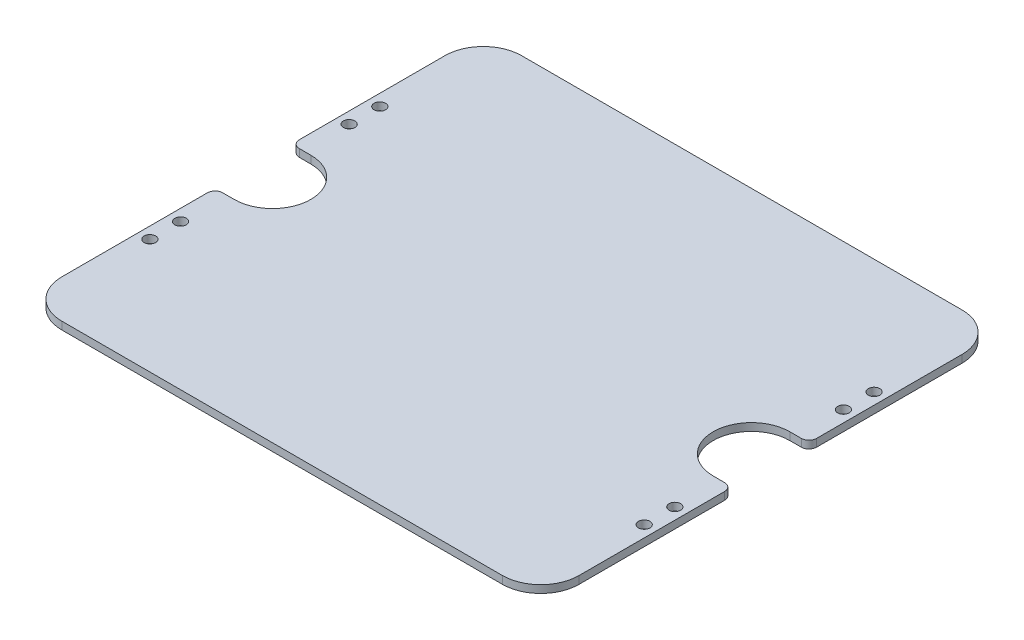
from build123d import *

# Parameters (mm, degrees)
SKETCH_1_R      = 1.5
EXTRUDE_1_DEPTH = 2


with BuildPart() as part:
    # 草图1 → 凸台-拉伸1 (new body)
    with BuildSketch(Plane(origin=(0, 0, 0), x_dir=(1, 0, 0), z_dir=(0, 1, 0))):
        with BuildLine():
            Line((-65.5, 10), (-62.5, 10))
            ThreePointArc((-62.5, 10), (-52.5, 0), (-62.5, -10))
            Line((-62.5, -10), (-65.5, -10))
            ThreePointArc((-65.5, -10), (-66.914213562, -10.585786438), (-67.5, -12))
            Line((-67.5, -12), (-67.5, -50))
            ThreePointArc((-67.5, -50), (-64.571067812, -57.071067812), (-57.5, -60))
            Line((-57.5, -60), (57.5, -60))
            ThreePointArc((57.5, -60), (64.571067812, -57.071067812), (67.5, -50))
            Line((67.5, -50), (67.5, -12))
            ThreePointArc((67.5, -12), (66.914213562, -10.585786438), (65.5, -10))
            Line((65.5, -10), (62.5, -10))
            ThreePointArc((62.5, -10), (52.5, 0), (62.5, 10))
            Line((62.5, 10), (65.5, 10))
            ThreePointArc((65.5, 10), (66.914213562, 10.585786438), (67.5, 12))
            Line((67.5, 12), (67.5, 50))
            ThreePointArc((67.5, 50), (64.571067812, 57.071067812), (57.5, 60))
            Line((57.5, 60), (-57.5, 60))
            ThreePointArc((-57.5, 60), (-64.571067812, 57.071067812), (-67.5, 50))
            Line((-67.5, 50), (-67.5, 12))
            ThreePointArc((-67.5, 12), (-66.914213562, 10.585786438), (-65.5, 10))
        make_face()
        with Locations(Location((-64.5, 30, 0), (0, 0, 270))):
            Circle(SKETCH_1_R, mode=Mode.SUBTRACT)
        with Locations(Location((64.5, 30, 0), (0, 0, 270))):
            Circle(SKETCH_1_R, mode=Mode.SUBTRACT)
        with Locations(Location((64.5, -30, 0), (0, 0, 270))):
            Circle(SKETCH_1_R, mode=Mode.SUBTRACT)
        with Locations(Location((-64.5, -30, 0), (0, 0, 270))):
            Circle(SKETCH_1_R, mode=Mode.SUBTRACT)
        with Locations(Location((-64.5, 22, 0), (0, 0, 270))):
            Circle(SKETCH_1_R, mode=Mode.SUBTRACT)
        with Locations(Location((64.5, 22, 0), (0, 0, 90))):
            Circle(SKETCH_1_R, mode=Mode.SUBTRACT)
        with Locations(Location((64.5, -22, 0), (0, 0, 270))):
            Circle(SKETCH_1_R, mode=Mode.SUBTRACT)
        with Locations(Location((-64.5, -22, 0), (0, 0, 90))):
            Circle(SKETCH_1_R, mode=Mode.SUBTRACT)
    extrude(amount=EXTRUDE_1_DEPTH)


solid = part.part
